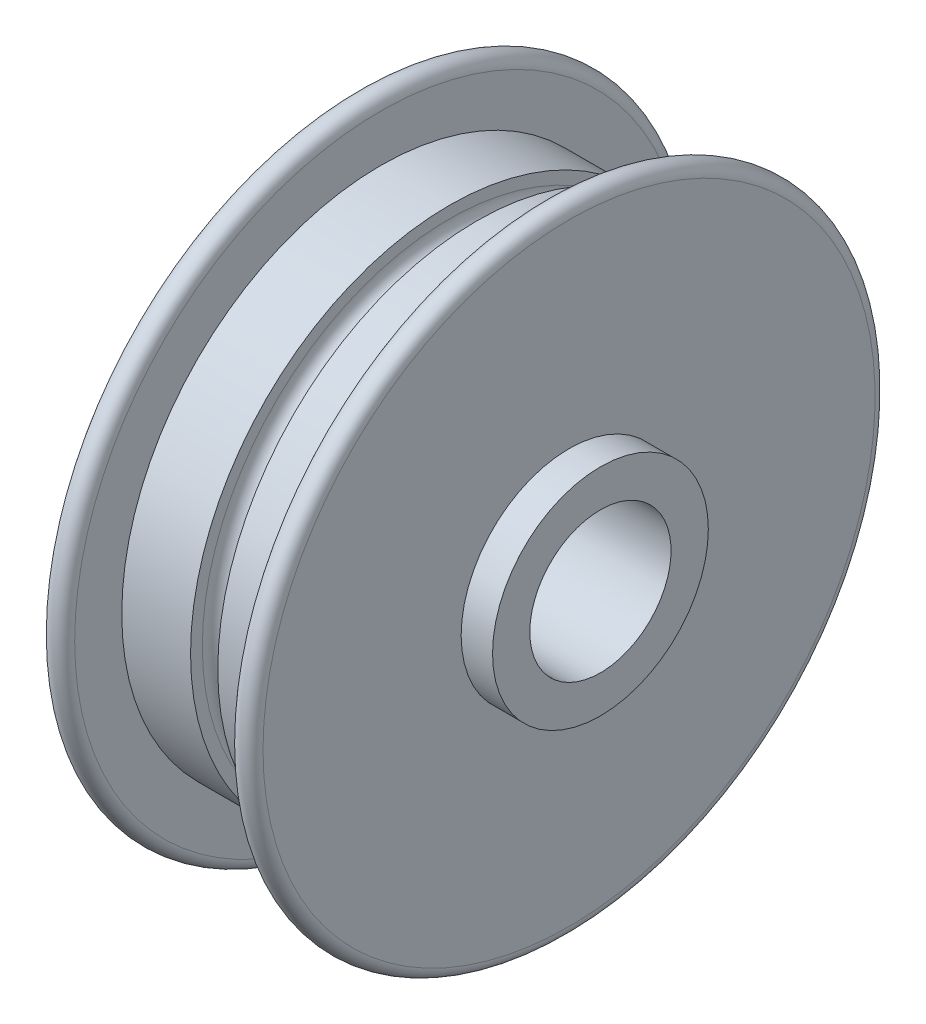
from build123d import *


with BuildPart() as part:
    # Çizim1 → Döndür1 (revolve)
    with BuildSketch(Plane.XY, mode=Mode.PRIVATE) as d_nd_r1_sk:
        with BuildLine():
            Line((0.000609889, 8.999999979), (0.000609889, 13.749999986))
            Line((0.000609889, 13.749999986), (4.000609889, 13.749999986))
            Line((4.000609889, 13.749999986), (4.000609889, 39))
            ThreePointArc((4.000609889, 39), (5.500609889, 40.5), (7.000609889, 39))
            Line((7.000609889, 39), (7.000609889, 33))
            Line((7.000609889, 33), (15.765897066, 33))
            Line((15.765897066, 33), (15.765897066, 31.5))
            ThreePointArc((15.765897066, 31.5), (17.500609889, 29.51919397), (19.235322712, 31.5))
            Line((19.235322712, 31.5), (19.235322712, 33))
            Line((19.235322712, 33), (28.000609889, 33))
            Line((28.000609889, 33), (28.000609889, 39))
            ThreePointArc((28.000609889, 39), (29.500609889, 40.5), (31.000609889, 39))
            Line((31.000609889, 39), (31.000609889, 13.749999986))
            Line((31.000609889, 13.749999986), (35.000609889, 13.749999986))
            Line((35.000609889, 13.749999986), (35.000609889, 8.999999979))
            Line((35.000609889, 8.999999979), (0.000609889, 8.999999979))
        make_face()
    revolve(d_nd_r1_sk.sketch.rotate(Axis((0, 0, 0), (1, 0, 0)), 90), axis=Axis((0, 0, 0), (1, 0, 0)))


solid = part.part
